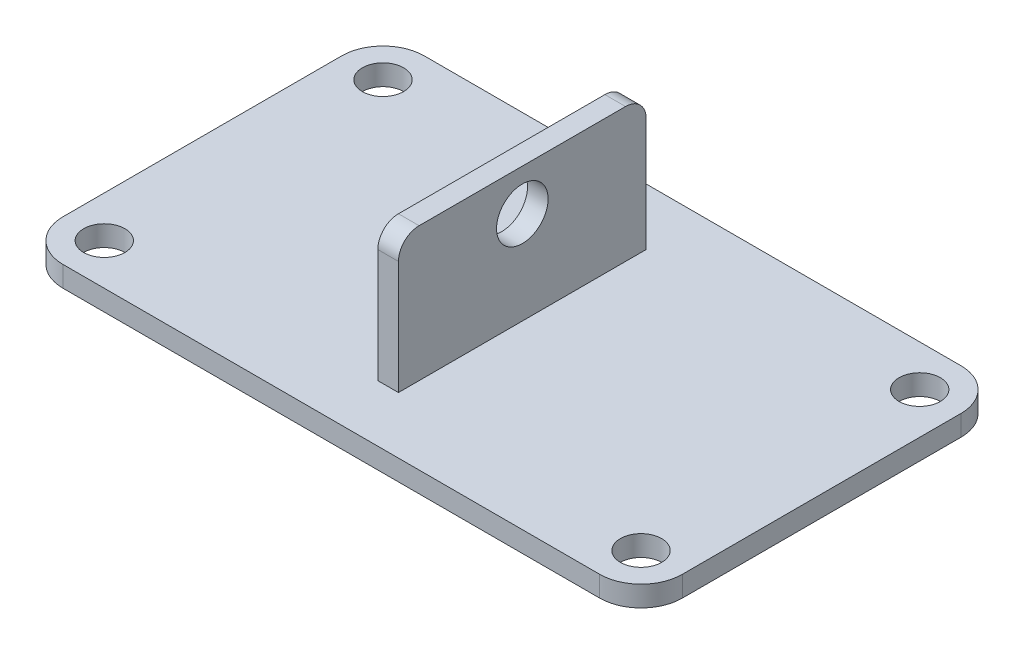
from build123d import *

# Parameters (mm, degrees)
SKETCH1_R           = 10
BOSS_EXTRUDE1_DEPTH = 10
SKETCH1_3_W         = 10
SKETCH1_3_H         = 120
BOSS_EXTRUDE2_DEPTH = 75
SKETCH2_R           = 12.5
CUT_EXTRUDE1_DEPTH  = 10


with BuildPart() as part:
    # Sketch1 → Boss-Extrude1 (new body)
    with BuildSketch(Plane(origin=(0, 0, 0), x_dir=(1, 0, 0), z_dir=(0, 1, 0))):
        with BuildLine():
            ThreePointArc((-150, -67.5), (-144.142135624, -81.642135624), (-130, -87.5))
            Line((-130, -87.5), (130, -87.5))
            ThreePointArc((130, -87.5), (144.142135624, -81.642135624), (150, -67.5))
            Line((150, -67.5), (150, 67.5))
            ThreePointArc((150, 67.5), (144.142135624, 81.642135624), (130, 87.5))
            Line((130, 87.5), (-130, 87.5))
            ThreePointArc((-130, 87.5), (-144.142135624, 81.642135624), (-150, 67.5))
            Line((-150, 67.5), (-150, -67.5))
        make_face()
        with Locations((-130, -67.5)):
            Circle(SKETCH1_R, mode=Mode.SUBTRACT)
        with Locations((130, -67.5)):
            Circle(SKETCH1_R, mode=Mode.SUBTRACT)
        with Locations((-130, 67.5)):
            Circle(SKETCH1_R, mode=Mode.SUBTRACT)
        with Locations((130, 67.5)):
            Circle(SKETCH1_R, mode=Mode.SUBTRACT)
    extrude(amount=BOSS_EXTRUDE1_DEPTH)

    # Sketch1<3> → Boss-Extrude2 (add)
    with BuildSketch(Plane(origin=(0, 0, 0), x_dir=(1, 0, 0), z_dir=(0, 1, 0))):
        Rectangle(SKETCH1_3_W, SKETCH1_3_H)
    extrude(amount=BOSS_EXTRUDE2_DEPTH)

    # Sketch2 → Cut-Extrude1 (cut)
    with BuildSketch(Plane(origin=(5, 0, 0), x_dir=(0, 0, -1), z_dir=(1, 0, 0))):
        with Locations((0, 55)):
            Circle(SKETCH2_R)
        with BuildLine():
            ThreePointArc((50, 75), (57.071067812, 72.071067812), (60, 65))
            Line((60, 65), (60, 75))
            Line((60, 75), (50, 75))
        make_face()
        with BuildLine():
            Line((-60, 75), (-60, 65))
            ThreePointArc((-60, 65), (-57.071067812, 72.071067812), (-50, 75))
            Line((-50, 75), (-60, 75))
        make_face()
    extrude(amount=-CUT_EXTRUDE1_DEPTH, mode=Mode.SUBTRACT)


solid = part.part
